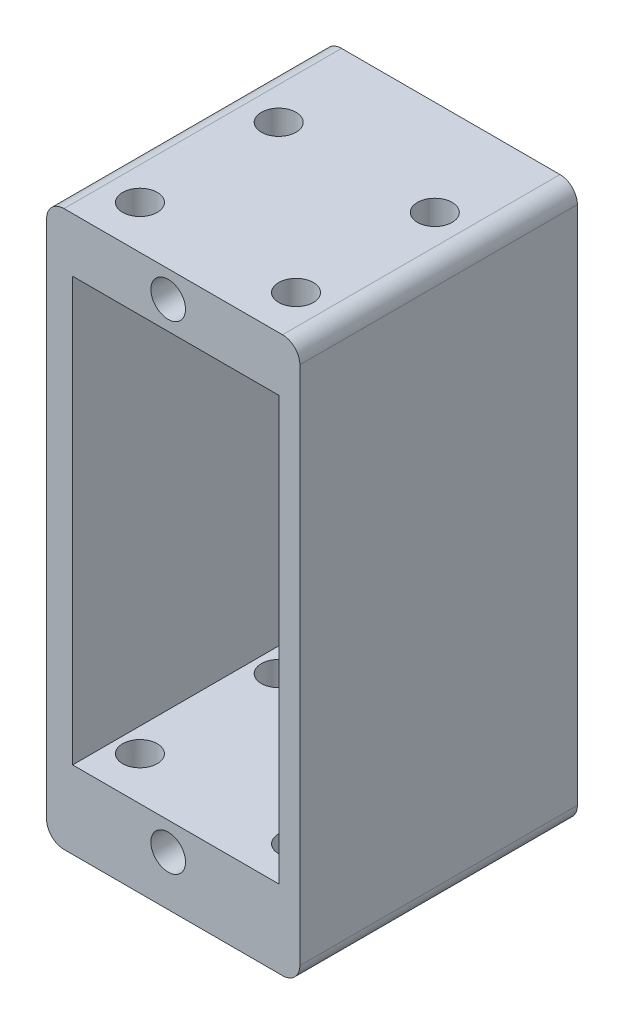
from build123d import *

# Parameters (mm, degrees)
SKETCH2_W           = 14.6
SKETCH2_H           = 32
BOSS_EXTRUDE1_DEPTH = 16
FILLET1_R           = 1
SKETCH3_W           = 11.9
SKETCH3_H           = 24.4
CUT_EXTRUDE1_DEPTH  = 16
SKETCH4_R           = 1
CUT_EXTRUDE2_DEPTH  = 16
SKETCH5_R           = 1
CUT_EXTRUDE3_DEPTH  = 113.555199241


with BuildPart() as part:
    # Sketch2 → Boss-Extrude1 (new body)
    with BuildSketch(Plane.XY):
        with Locations((-99.41772522, 219.327818509)):
            Rectangle(SKETCH2_W, SKETCH2_H)
    extrude(amount=BOSS_EXTRUDE1_DEPTH)

    # Fillet1
    fillet1_edges = [part.edges().sort_by_distance(p)[0] for p in [
        (-106.71772522, 235.327818509, 8),
        (-92.11772522, 235.327818509, 8),
        (-92.11772522, 203.327818509, 8),
        (-106.71772522, 203.327818509, 8),
    ]]
    fillet(fillet1_edges, radius=FILLET1_R)

    # Sketch3 → Cut-Extrude1 (cut)
    with BuildSketch(Plane.XY.offset(16)):
        with Locations((-99.26772522, 219.999996948)):
            Rectangle(SKETCH3_W, SKETCH3_H)
    extrude(amount=-CUT_EXTRUDE1_DEPTH, mode=Mode.SUBTRACT)

    # Sketch4 → Cut-Extrude2 (cut)
    with BuildSketch(Plane.XY.offset(16)):
        with Locations((-99.709122305, 233.799996948)):
            Circle(SKETCH4_R)
        with Locations((-99.709122305, 206.199996948)):
            Circle(SKETCH4_R)
    extrude(amount=-CUT_EXTRUDE2_DEPTH, mode=Mode.SUBTRACT)

    # Sketch5 → Cut-Extrude3 (cut, through all)
    with BuildSketch(Plane(origin=(0, 235.327818509, 0), x_dir=(1, 0, 0), z_dir=(0, 1, 0))):
        with Locations(Location((-103.837557169, -5.5, 0), (0, 0, 270))):
            Circle(SKETCH5_R)
        with Locations(Location((-94.837557169, -5.5, 0), (0, 0, 270))):
            Circle(SKETCH5_R)
        with Locations(Location((-94.837557169, -13.5, 0), (0, 0, 270))):
            Circle(SKETCH5_R)
        with Locations(Location((-103.837557169, -13.5, 0), (0, 0, 270))):
            Circle(SKETCH5_R)
    extrude(amount=-CUT_EXTRUDE3_DEPTH, mode=Mode.SUBTRACT)


solid = part.part
